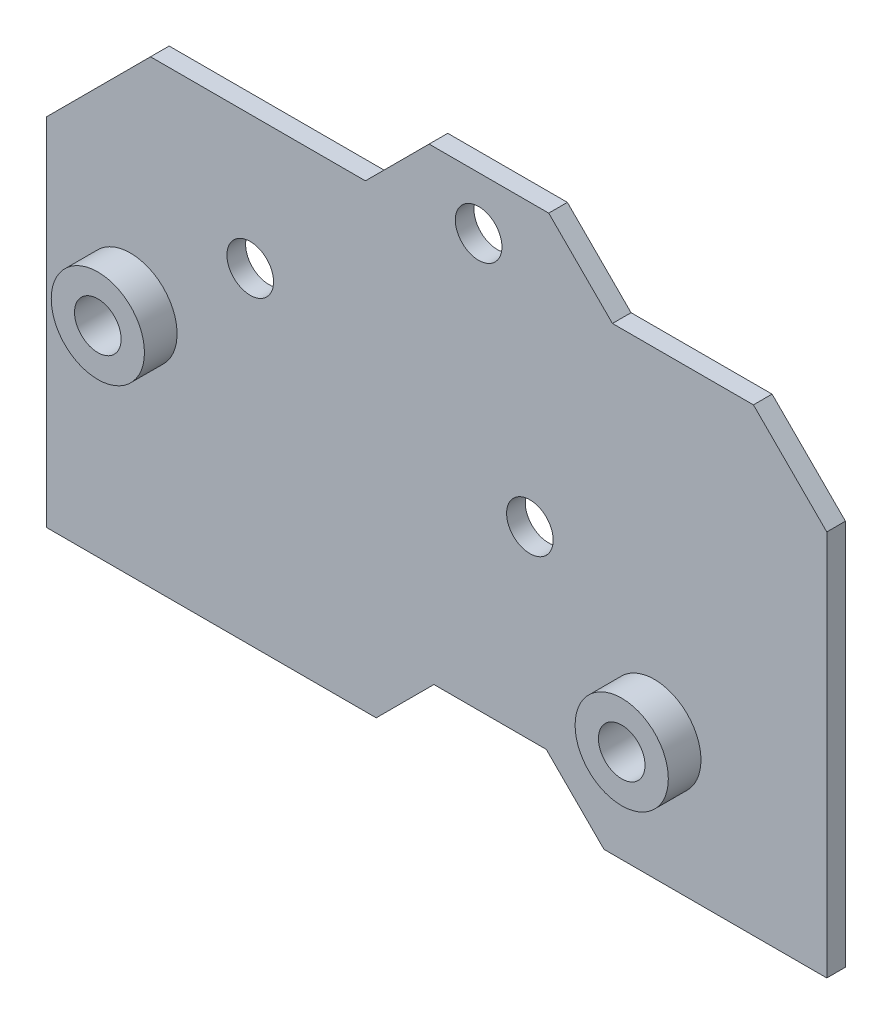
from build123d import *

# Parameters (mm, degrees)
SKETCH_1_R          = 2.5
EXTRUDE_1_DEPTH     = 2
SKETCH_2_R          = 5
SKETCH_2_R_2        = 2.5
EXTRUDE_3_DEPTH     = 3.5
CUT_EXTRUDE_1_REACH = 52.835
SKETCH_2_2_R        = 2.5


with BuildPart() as part:
    # 스케치1 → 보스-돌출1 (new body)
    with BuildSketch(Plane.XY):
        Polygon((-6.486435689, -27.5), (-0.294279728, -21.307844039), (11.756387017, -21.307844039), (17.948542978, -27.5), (41.84943397, -27.5), (41.84943397, 13.941912539), (33.979452522, 21.811893988), (18.854924629, 21.811893988), (12.020959992, 28.645858624), (-0.811850652, 28.645858624), (-7.645815288, 21.811893988), (-30.698580055, 21.811893988), (-41.84943397, 10.661040072), (-41.84943397, -27.5), align=None)
        with Locations((-20, 7.5)):
            Circle(SKETCH_1_R, mode=Mode.SUBTRACT)
        with Locations((4.5, 23)):
            Circle(SKETCH_1_R, mode=Mode.SUBTRACT)
        with Locations((10, -1.5)):
            Circle(SKETCH_1_R, mode=Mode.SUBTRACT)
    extrude(amount=EXTRUDE_1_DEPTH)

    # 스케치2 → 보스-돌출3 (add)
    # profile 1 of 2: a face of its own
    with BuildSketch(Plane.XY.offset(2)):
        with Locations((-32.84943397, -2.5)):
            Circle(SKETCH_2_R)
        with Locations((-32.84943397, -2.5)):
            Circle(SKETCH_2_R_2, mode=Mode.SUBTRACT)
    # profile 2 of 2: a face of its own
    with BuildSketch(Plane.XY.offset(2)):
        with Locations((23.34943397, -14)):
            Circle(SKETCH_2_R)
        with Locations((23.34943397, -14)):
            Circle(SKETCH_2_R_2, mode=Mode.SUBTRACT)
    extrude(amount=EXTRUDE_3_DEPTH)

    # 스케치2<2> → 컷-돌출1 (cut, up to next)
    with BuildSketch(Plane.XY.offset(2), mode=Mode.PRIVATE) as cut_extrude_1_sk1:
        with Locations((-32.84943397, -2.5)):
            Circle(SKETCH_2_2_R)
    cut_extrude_1_tool1 = extrude(cut_extrude_1_sk1.sketch, amount=-CUT_EXTRUDE_1_REACH, mode=Mode.PRIVATE) & part.part
    # 스케치2<2> → 컷-돌출1 (cut, up to next)
    with BuildSketch(Plane.XY.offset(2), mode=Mode.PRIVATE) as cut_extrude_1_sk2:
        with Locations((23.34943397, -14)):
            Circle(SKETCH_2_2_R)
    cut_extrude_1_tool2 = extrude(cut_extrude_1_sk2.sketch, amount=-CUT_EXTRUDE_1_REACH, mode=Mode.PRIVATE) & part.part
    add(cut_extrude_1_tool1.solids().sort_by_distance((-32.849434, -2.5, 2))[0], mode=Mode.SUBTRACT)
    add(cut_extrude_1_tool2.solids().sort_by_distance((23.349434, -14, 2))[0], mode=Mode.SUBTRACT)


solid = part.part
